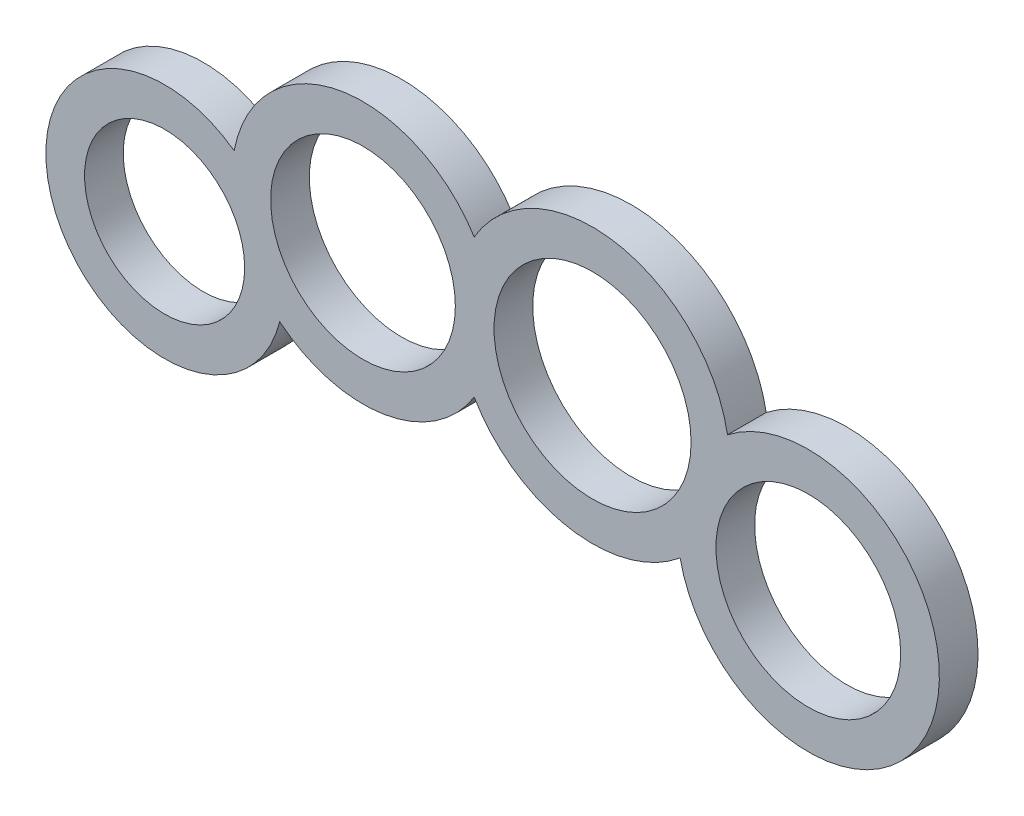
from build123d import *

# Parameters (mm, degrees)
BOSS_EXTRUDE2_DEPTH = 5
SKETCH2_R           = 10.345071301
CUT_EXTRUDE1_DEPTH  = 5
SKETCH3_R           = 11.936620732
CUT_EXTRUDE2_DEPTH  = 5
SKETCH5_R           = 12.732395447
CUT_EXTRUDE3_DEPTH  = 5
SKETCH6_R           = 11.936620732
CUT_EXTRUDE4_DEPTH  = 5


with BuildPart() as part:
    # Sketch1 → Boss-Extrude2 (new body)
    with BuildSketch(Plane.XY):
        with BuildLine():
            ThreePointArc((-10.756876138, -13.082000519), (2.738805764, -16.713708888), (14.369566376, -8.964635184))
            ThreePointArc((14.369566376, -8.964635184), (26.589818025, -17.463000516), (40.979710452, -13.656721546))
            ThreePointArc((40.979710452, -13.656721546), (73.463989272, -15.940066616), (47.111882074, 3.191281517))
            ThreePointArc((47.111882074, 3.191281517), (32.748214335, 17.463000516), (14.369566376, 8.964635184))
            ThreePointArc((14.369566376, 8.964635184), (-3.142789543, 16.642475648), (-16.649193034, 3.107007102))
            ThreePointArc((-16.649193034, 3.107007102), (-40.05605495, -14.579211704), (-10.756876138, -13.082000519))
        make_face()
    extrude(amount=BOSS_EXTRUDE2_DEPTH)

    # Sketch2 → Cut-Extrude1 (cut)
    with BuildSketch(Plane.XY.offset(5)):
        with Locations((-25.636404683, -9.330888218)):
            Circle(SKETCH2_R)
    extrude(amount=-CUT_EXTRUDE1_DEPTH, mode=Mode.SUBTRACT)

    # Sketch3 → Cut-Extrude2 (cut)
    with BuildSketch(Plane.XY.offset(5)):
        Circle(SKETCH3_R)
    extrude(amount=-CUT_EXTRUDE2_DEPTH, mode=Mode.SUBTRACT)

    # Sketch5 → Cut-Extrude3 (cut)
    with BuildSketch(Plane.XY.offset(5)):
        with Locations((29.66901618, 0)):
            Circle(SKETCH5_R)
    extrude(amount=-CUT_EXTRUDE3_DEPTH, mode=Mode.SUBTRACT)

    # Sketch6 → Cut-Extrude4 (cut)
    with BuildSketch(Plane.XY.offset(5)):
        with Locations((57.54877175, -10.147401166)):
            Circle(SKETCH6_R)
    extrude(amount=-CUT_EXTRUDE4_DEPTH, mode=Mode.SUBTRACT)


solid = part.part
